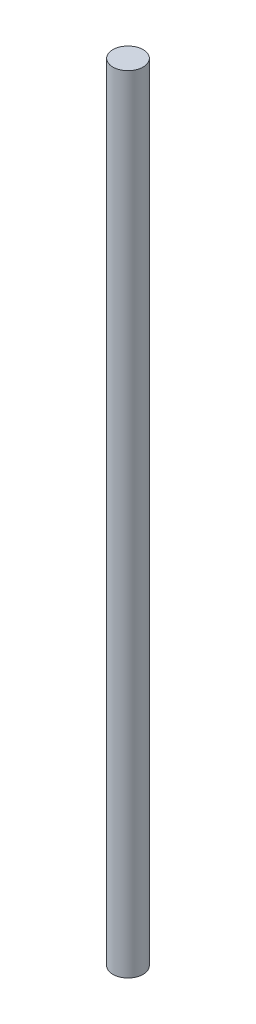
from build123d import *

# Parameters (mm, degrees)
SKETCH8_R           = 1.27
BOSS_EXTRUDE2_DEPTH = 66.04


with BuildPart() as part:
    # Sketch8 → Boss-Extrude2 (new body)
    with BuildSketch(Plane(origin=(0, 0, 0), x_dir=(1, 0, 0), z_dir=(0, 1, 0))):
        with Locations(Location((0, 0, 0), (0, 0, 270))):
            Circle(SKETCH8_R)
    extrude(amount=BOSS_EXTRUDE2_DEPTH)


solid = part.part
